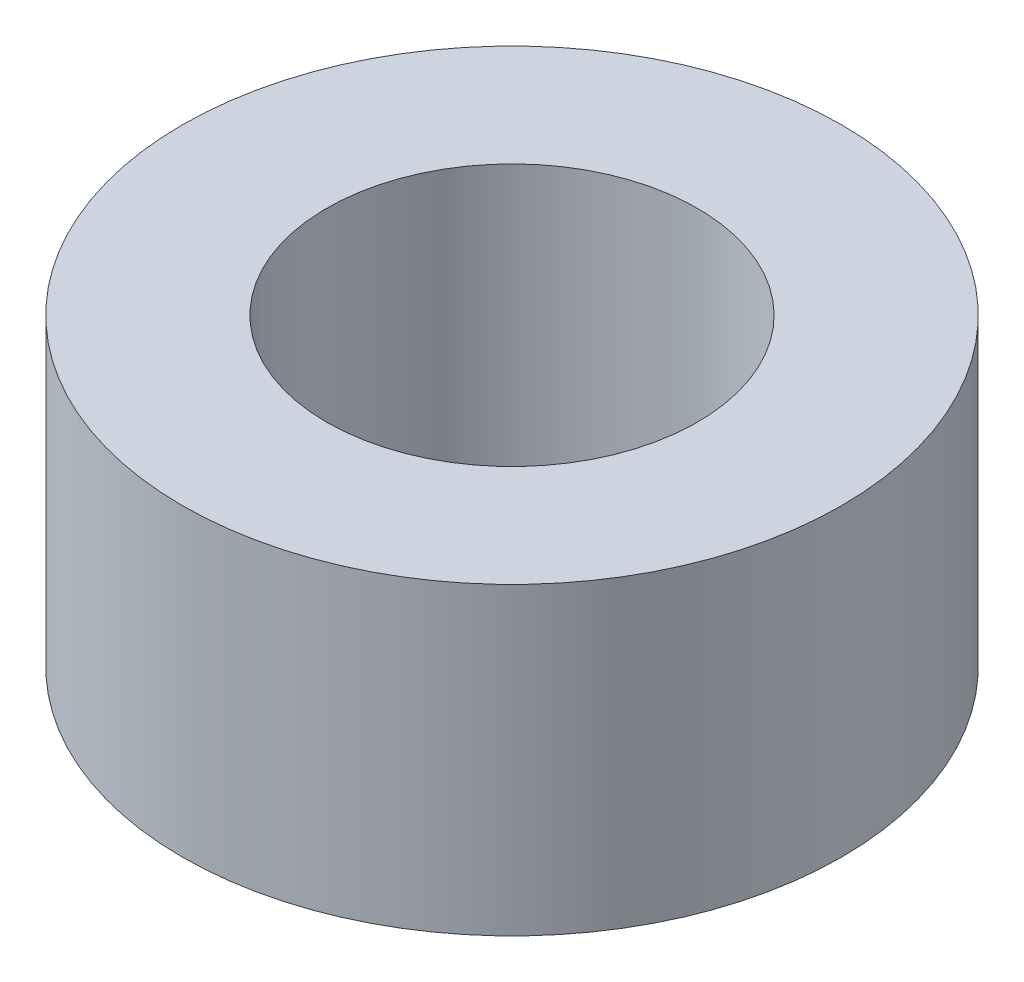
from build123d import *

# Parameters (mm, degrees)
SKETCH1_R           = 14.23
BOSS_EXTRUDE1_DEPTH = 13.14
SKETCH2_R           = 8
CUT_EXTRUDE1_DEPTH  = 13.14


with BuildPart() as part:
    # Sketch1 → Boss-Extrude1 (new body)
    with BuildSketch(Plane(origin=(0, 0, 0), x_dir=(1, 0, 0), z_dir=(0, 1, 0))):
        with Locations(Location((0, 0, 0), (0, 0, 270))):
            Circle(SKETCH1_R)
    extrude(amount=BOSS_EXTRUDE1_DEPTH)

    # Sketch2 → Cut-Extrude1 (cut)
    with BuildSketch(Plane(origin=(0, 13.14, 0), x_dir=(1, 0, 0), z_dir=(0, 1, 0))):
        with Locations(Location((0, 0, 0), (0, 0, 270))):
            Circle(SKETCH2_R)
    extrude(amount=-CUT_EXTRUDE1_DEPTH, mode=Mode.SUBTRACT)


solid = part.part
